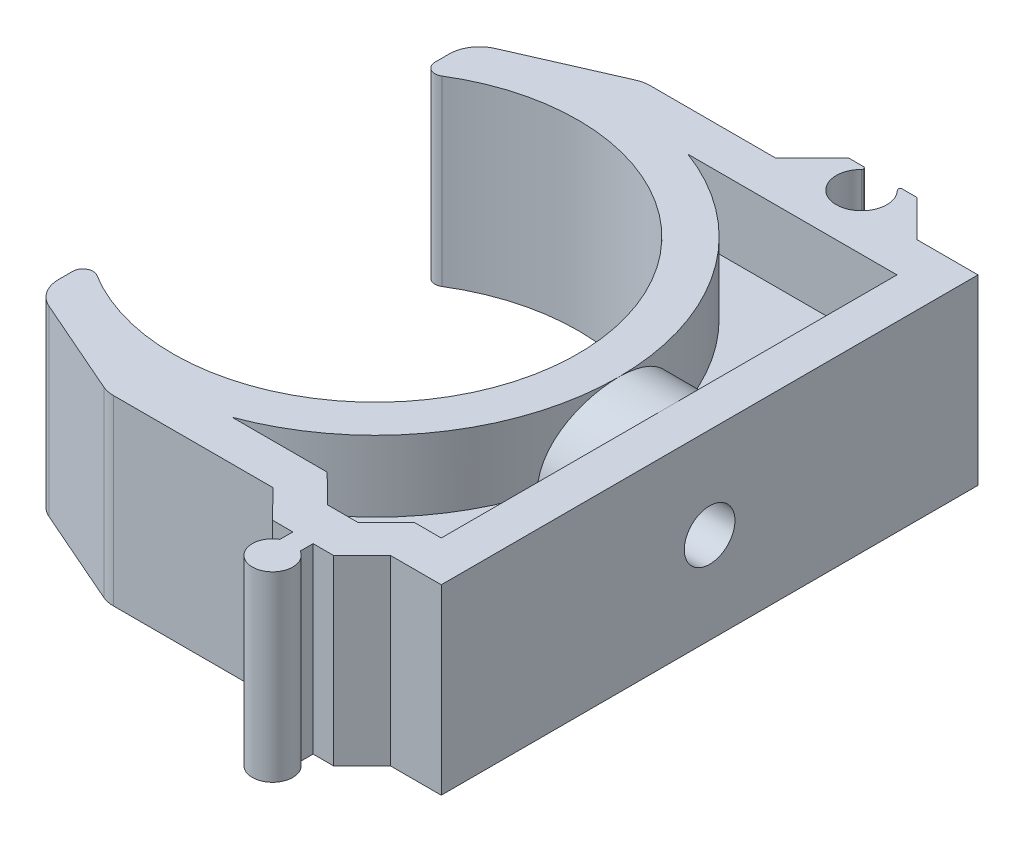
from build123d import *

# Parameters (mm, degrees)
BOSS_EXTRUDE1_DEPTH = 18
CUT_EXTRUDE1_DEPTH  = 7
BOSS_EXTRUDE2_DEPTH = 7
SKETCH4_R           = 2.5
CUT_EXTRUDE2_DEPTH  = 6
SKETCH5_R           = 5.75
CUT_EXTRUDE3_DEPTH  = 7
CUT_EXTRUDE4_START  = -7
SKETCH6_R           = 5.75
CUT_EXTRUDE4_DEPTH  = 7
SCALE1_SCALE        = 0.75
SCALE2_SCALE        = 1.066666667


with BuildPart() as part:
    # Sketch1 → Boss-Extrude1 (new body)
    with BuildSketch(Plane(origin=(0, 0, 0), x_dir=(1, 0, 0), z_dir=(0, 1, 0))):
        with BuildLine():
            Line((10.653013329, -29.309744988), (10.653013329, -30.57769418))
            ThreePointArc((10.653013329, -30.57769418), (11.653013329, -34.309744988), (12.653013329, -30.57769418))
            Line((12.653013329, -30.57769418), (12.653013329, -29.309744988))
            Line((12.653013329, -29.309744988), (14.653013329, -29.309744988))
            Line((14.653013329, -29.309744988), (17.5, -26.5))
            Line((17.5, -26.5), (22.5, -26.5))
            Line((22.5, -26.5), (22.5, 26.5))
            Line((22.5, 26.5), (16.5, 26.5))
            Line((16.5, 26.5), (12.844502727, 30.107679392))
            Line((12.844502727, 30.107679392), (11.410696035, 30.107679392))
            ThreePointArc((11.410696035, 30.107679392), (11.225950376, 29.984289062), (11.269162996, 29.766369807))
            ThreePointArc((11.269162996, 29.766369807), (9.5, 25.5), (7.730837004, 29.766369807))
            ThreePointArc((7.730837004, 29.766369807), (7.774049624, 29.984289062), (7.589303965, 30.107679392))
            Line((7.589303965, 30.107679392), (6.155497273, 30.107679392))
            Line((6.155497273, 30.107679392), (2.5, 26.5))
            Line((2.5, 26.5), (-9.870833143, 26.5))
            ThreePointArc((-9.870833143, 26.5), (-10.486603861, 26.436124388), (-11.076152757, 26.247217616))
            Line((-11.076152757, 26.247217616), (-20.702456422, 22.023754373))
            Line((-20.702456422, 22.023754373), (-20.705319614, 22.022498171))
            ThreePointArc((-20.705319614, 22.022498171), (-22.011569115, 20.916018371), (-22.5, 19.275280555))
            Line((-22.5, 19.275280555), (-22.5, 17.88854382))
            ThreePointArc((-22.5, 17.88854382), (-21.987950036, 17.015672259), (-20.976190476, 17.0367084))
            ThreePointArc((-20.976190476, 17.0367084), (9.5, 0), (-20.976190476, -17.0367084))
            ThreePointArc((-20.976190476, -17.0367084), (-21.987950036, -17.015672259), (-22.5, -17.88854382))
            Line((-22.5, -17.88854382), (-22.5, -19.287953276))
            ThreePointArc((-22.5, -19.287953276), (-22.010713993, -20.929999331), (-20.702456502, -22.03642528))
            Line((-20.702456502, -22.03642528), (-11.074921132, -26.248472005))
            ThreePointArc((-11.074921132, -26.248472005), (-10.486705619, -26.43644479), (-9.87246463, -26.5))
            Line((-9.87246463, -26.5), (5.880022863, -26.5))
            Line((5.880022863, -26.5), (8.653013329, -29.309744988))
            Line((8.653013329, -29.309744988), (10.653013329, -29.309744988))
        make_face()
    extrude(amount=BOSS_EXTRUDE1_DEPTH)

    # Sketch2 → Cut-Extrude1 (cut)
    with BuildSketch(Plane.XZ):
        with BuildLine():
            Line((18.5, 22.5), (18.5, -22.5))
            Line((18.5, -22.5), (-2.148353456, -22.5))
            ThreePointArc((-2.148353456, -22.5), (13.5, 0), (-2.148353456, 22.5))
            Line((-2.148353456, 22.5), (7.238559187, 22.5))
            Line((7.238559187, 22.5), (10.039345887, 25.282038261))
            Line((10.039345887, 25.282038261), (13.039345883, 25.282178795))
            Line((13.039345883, 25.282178795), (15.843268341, 22.5))
            Line((15.843268341, 22.5), (18.5, 22.5))
        make_face()
    cut_extrude1 = extrude(amount=-CUT_EXTRUDE1_DEPTH, mode=Mode.SUBTRACT)

    # Mirror1: Cut-Extrude1 across plane
    add(cut_extrude1.mirror(Plane(origin=(0, 9, 0), x_dir=(0, 0, 1), z_dir=(0, -1, 0))), mode=Mode.SUBTRACT)

    # Sketch3 → Boss-Extrude2 (add)
    with BuildSketch(Plane.ZY.offset(-18.5)):
        with BuildLine():
            Line((7, 7), (-7, 7))
            ThreePointArc((-7, 7), (0, 0), (7, 7))
        make_face()
    boss_extrude2 = extrude(amount=BOSS_EXTRUDE2_DEPTH)

    # Mirror2: Boss-Extrude2 across plane
    add(boss_extrude2.mirror(Plane(origin=(0, 9, 0), x_dir=(0, 0, 1), z_dir=(0, -1, 0))))

    # Sketch4 → Cut-Extrude2 (cut)
    with BuildSketch(Plane(origin=(22.5, 0, 0), x_dir=(0, 0, -1), z_dir=(1, 0, 0))):
        with Locations((0, 9)):
            Circle(SKETCH4_R)
    extrude(amount=-CUT_EXTRUDE2_DEPTH, mode=Mode.SUBTRACT)

    # Sketch5 → Cut-Extrude3 (cut)
    with BuildSketch(Plane(origin=(9.5, 0, 0), x_dir=(0, 0, -1), z_dir=(1, 0, 0))):
        with Locations((0, 9)):
            Circle(SKETCH5_R)
    extrude(amount=-CUT_EXTRUDE3_DEPTH, mode=Mode.SUBTRACT)

    # Sketch6 → Cut-Extrude4 (cut)
    with BuildSketch(Plane.ZY.offset(-9.5).offset(CUT_EXTRUDE4_START)):
        with Locations(Location((0, 9, 0), (0, 0, 180))):
            Circle(SKETCH6_R)
    extrude(amount=CUT_EXTRUDE4_DEPTH, mode=Mode.SUBTRACT)


with BuildPart() as part_1:
    # Scale1: scaled about (0, 0, 0)
    add(part.part.scale(SCALE1_SCALE))


with BuildPart() as part_2:
    # Scale2: scaled about (0, 0, 0)
    add(part_1.part.scale(SCALE2_SCALE))


solid = part_2.part
